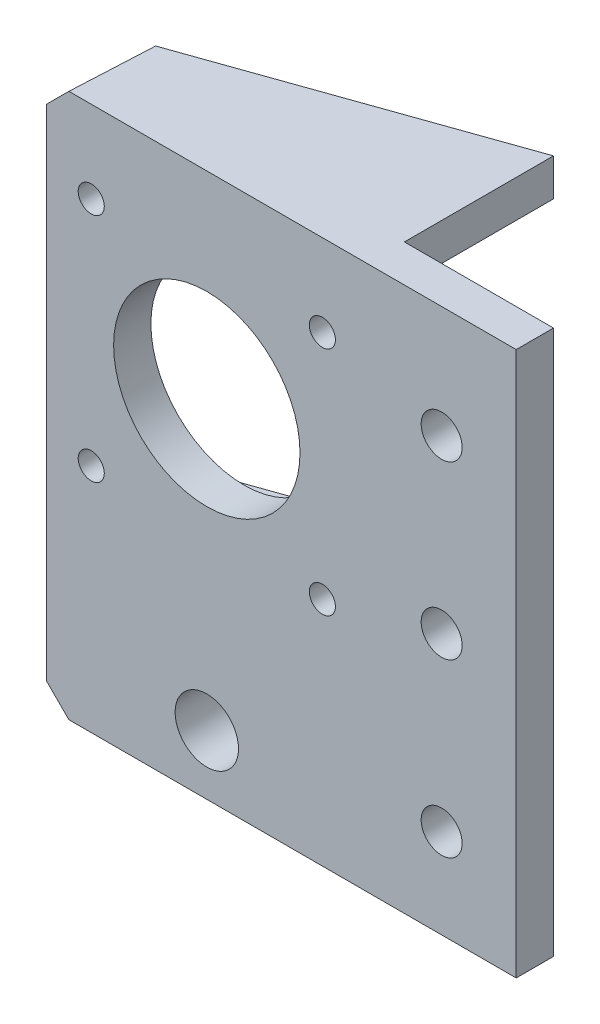
from build123d import *

# Parameters (mm, degrees)
SKETCH_2_W          = 63
SKETCH_2_H          = 43
SKETCH_2_R          = 1.75
SKETCH_2_R_2        = 12.5
SKETCH_2_R_3        = 2.75
EXTRUDE_1_DEPTH     = 5
SKETCH_3_W          = 63
SKETCH_3_H          = 5
EXTRUDE_2_DEPTH     = 25
SKETCH_4_R          = 4.25
CUT_EXTRUDE_2_DEPTH = 25
SKETCH_5_R          = 7.75
SKETCH_5_R_2        = 4.25
EXTRUDE_3_DEPTH     = 10
EXTRUDE_4_DEPTH     = 5
EXTRUDE_5_DEPTH     = 5
SKETCH_10_R         = 2.75
CUT_EXTRUDE_3_DEPTH = 75.939521233
SKETCH_11_W         = 20
SKETCH_11_H         = 5
EXTRUDE_6_DEPTH     = 5
CHAMFER_1_SIZE      = 3


with BuildPart() as part:
    # 草图2 → 凸台-拉伸1 (new body)
    with BuildSketch(Plane.XY):
        with Locations((11.527972028, -9.531468531)):
            Rectangle(SKETCH_2_W, SKETCH_2_H)
        with Locations((-13.972027972, 5.968531469)):
            Circle(SKETCH_2_R, mode=Mode.SUBTRACT)
        with Locations((17.027972028, 5.968531469)):
            Circle(SKETCH_2_R, mode=Mode.SUBTRACT)
        with Locations((17.027972028, -25.031468531)):
            Circle(SKETCH_2_R, mode=Mode.SUBTRACT)
        with Locations((-13.972027972, -25.031468531)):
            Circle(SKETCH_2_R, mode=Mode.SUBTRACT)
        with Locations((1.527972028, -9.531468531)):
            Circle(SKETCH_2_R_2, mode=Mode.SUBTRACT)
        with Locations((33.027972028, 1.968531469)):
            Circle(SKETCH_2_R_3, mode=Mode.SUBTRACT)
        with Locations((33.027972028, -21.031468531)):
            Circle(SKETCH_2_R_3, mode=Mode.SUBTRACT)
    extrude(amount=EXTRUDE_1_DEPTH)

    # 草图3 → 凸台-拉伸2 (add)
    with BuildSketch(Plane.XZ.offset(31.031468531)):
        with Locations((11.527972028, 2.5)):
            Rectangle(SKETCH_3_W, SKETCH_3_H)
    extrude(amount=EXTRUDE_2_DEPTH)

    # 草图4 → 切除-拉伸2 (cut)
    with BuildSketch(Plane.XY.offset(5)):
        with Locations((1.527972028, -48.031468531)):
            Circle(SKETCH_4_R)
    extrude(amount=-CUT_EXTRUDE_2_DEPTH, mode=Mode.SUBTRACT)

    # 草图5 → 凸台-拉伸3 (add)
    with BuildSketch(Plane(origin=(0, 0, 0), x_dir=(-1, 0, 0), z_dir=(0, 0, -1))):
        with Locations(Location((-1.527972028, -48.031468531, 0), (0, 0, 180))):
            Circle(SKETCH_5_R)
        with Locations(Location((-1.527972028, -48.031468531, 0), (0, 0, 180))):
            Circle(SKETCH_5_R_2, mode=Mode.SUBTRACT)
    extrude(amount=EXTRUDE_3_DEPTH)

    # 草图7 → 凸台-拉伸4 (add)
    with BuildSketch(Plane(origin=(0, 11.968531469, 0), x_dir=(1, 0, 0), z_dir=(0, 1, 0))):
        Polygon((-19.972027972, -5), (-19.472027972, 5), (23.027972028, 20), (23.027972028, -5), align=None)
    extrude(amount=EXTRUDE_4_DEPTH)

    # 草图8 → 凸台-拉伸5 (add)
    with BuildSketch(Plane(origin=(0, -31.031468531, 0), x_dir=(-1, 0, 0), z_dir=(0, -1, 0))):
        Polygon((-23.027972028, 20), (-23.027972028, 0), (19.722027972, 0), (19.472027972, 5), align=None)
    extrude(amount=EXTRUDE_5_DEPTH)

    # 草图10 → 切除-拉伸3 (cut, through all)
    with BuildSketch(Plane.XY.offset(5)):
        with Locations((33.027972028, -44.031468531)):
            Circle(SKETCH_10_R)
    extrude(amount=-CUT_EXTRUDE_3_DEPTH, mode=Mode.SUBTRACT)

    # 草图11 → 凸台-拉伸6 (add)
    with BuildSketch(Plane(origin=(0, 11.968531469, 0), x_dir=(1, 0, 0), z_dir=(0, 1, 0))):
        with Locations((33.027972028, -2.5)):
            Rectangle(SKETCH_11_W, SKETCH_11_H)
    extrude(amount=EXTRUDE_6_DEPTH)

    # 倒角1
    chamfer_1_edges = [part.edges().sort_by_distance(p)[0] for p in [
        (-19.972027972, -56.031468531, 2.5),
        (-19.722027972, 16.968531469, 0),
    ]]
    chamfer(chamfer_1_edges, length=CHAMFER_1_SIZE)


solid = part.part
